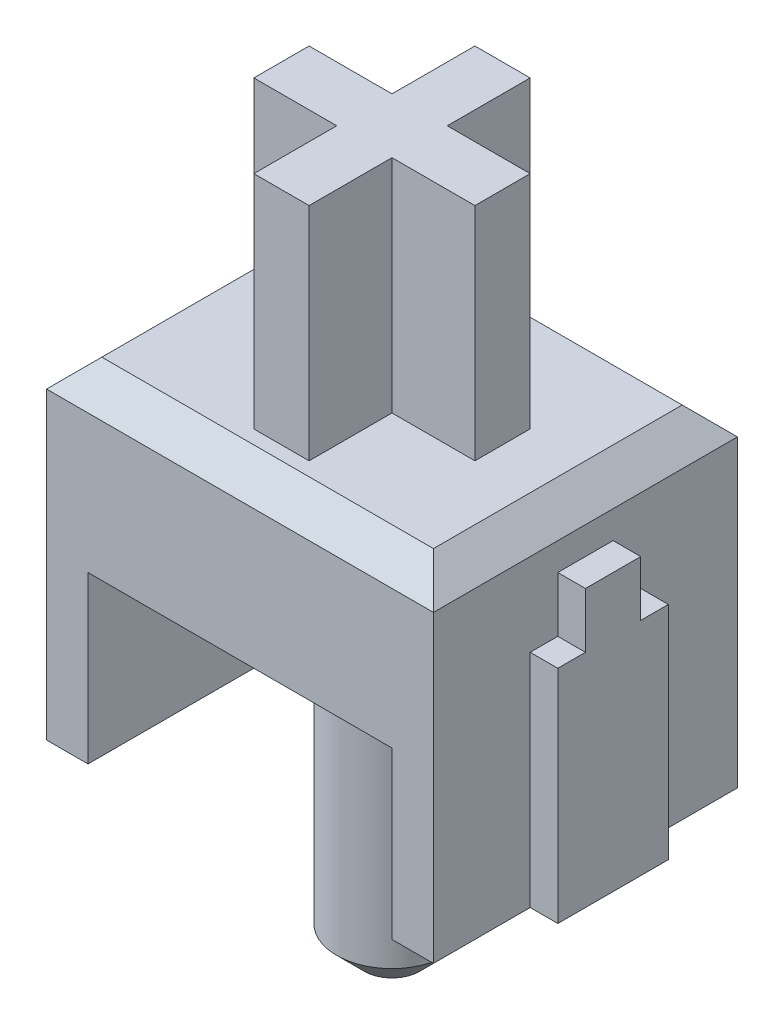
from build123d import *

# Parameters (mm, degrees)
ESQUISSE1_W             = 7
ESQUISSE1_H             = 5.5
BOSS_EXTRU_1_DEPTH      = 6
BOSS_EXTRU_2_DEPTH      = 0.5
BOSS_EXTRU_2_DEPTH_BACK = 7.5
ESQUISSE2_W             = 5.5
ESQUISSE2_H             = 5.5
ENL_V_MAT_EXTRU_2_DEPTH = 3
ESQUISSE4_W             = 1.5
ESQUISSE4_H             = 1
ESQUISSE4_W_2           = 1
ESQUISSE4_H_2           = 1.5
BOSS_EXTRU_3_DEPTH      = 4
ESQUISSE5_R             = 2
ENL_V_MAT_EXTRU_3_DEPTH = 2
ESQUISSE6_R             = 1
BOSS_EXTRU_4_DEPTH      = 8
CHANFREIN1_SIZE         = 0.5


with BuildPart() as part:
    # Esquisse1 → Boss.-Extru.1 (new body)
    with BuildSketch(Plane(origin=(0, 0, 0), x_dir=(1, 0, 0), z_dir=(0, 1, 0))):
        Rectangle(ESQUISSE1_W, ESQUISSE1_H)
    extrude(amount=BOSS_EXTRU_1_DEPTH)

    # Esquisse3 → Boss.-Extru.2 (add, two sides: drawn at the far end of the back side and taken through both)
    with BuildSketch(Plane.ZY.offset(3.5).offset(-BOSS_EXTRU_2_DEPTH_BACK)):
        Polygon((0, 0), (-1, 0), (-1, 4), (-0.5, 4), (-0.5, 5), (0.5, 5), (0.5, 4), (1, 4), (1, 0), align=None)
    extrude(amount=BOSS_EXTRU_2_DEPTH + BOSS_EXTRU_2_DEPTH_BACK)

    # Esquisse2 → Enlèv. mat.-Extru.2 (cut)
    with BuildSketch(Plane.XZ):
        Rectangle(ESQUISSE2_W, ESQUISSE2_H)
    extrude(amount=-ENL_V_MAT_EXTRU_2_DEPTH, mode=Mode.SUBTRACT)

    # Esquisse4 → Boss.-Extru.3 (add)
    with BuildSketch(Plane(origin=(0, 6, 0), x_dir=(1, 0, 0), z_dir=(0, 1, 0))):
        with Locations((1.25, 0)):
            Rectangle(ESQUISSE4_W, ESQUISSE4_H)
        with Locations((0, -1.25)):
            Rectangle(ESQUISSE4_W_2, ESQUISSE4_H_2)
        with Locations((-1.25, 0)):
            Rectangle(ESQUISSE4_W, ESQUISSE4_H)
        Rectangle(ESQUISSE4_W_2, ESQUISSE4_H)
        with Locations((0, 1.25)):
            Rectangle(ESQUISSE4_W_2, ESQUISSE4_H_2)
    extrude(amount=BOSS_EXTRU_3_DEPTH)

    # Esquisse5 → Enlèv. mat.-Extru.3 (cut)
    with BuildSketch(Plane.XZ.offset(-3)):
        with Locations(Location((0, 0, 0), (0, 0, 270))):
            Circle(ESQUISSE5_R)
    extrude(amount=-ENL_V_MAT_EXTRU_3_DEPTH, mode=Mode.SUBTRACT)

    # Esquisse6 → Boss.-Extru.4 (add)
    with BuildSketch(Plane.XZ.offset(-5)):
        with Locations(Location((0, 0, 0), (0, 0, 270))):
            Circle(ESQUISSE6_R)
    extrude(amount=BOSS_EXTRU_4_DEPTH)

    # Chanfrein1
    chanfrein1_edges = [part.edges().sort_by_distance(p)[0] for p in [
        (0, -3, 1),
        (-3.5, 6, 0),
        (0, 6, 2.75),
        (3.5, 6, 0),
        (0, 6, -2.75),
    ]]
    chamfer(chanfrein1_edges, length=CHANFREIN1_SIZE)


solid = part.part
